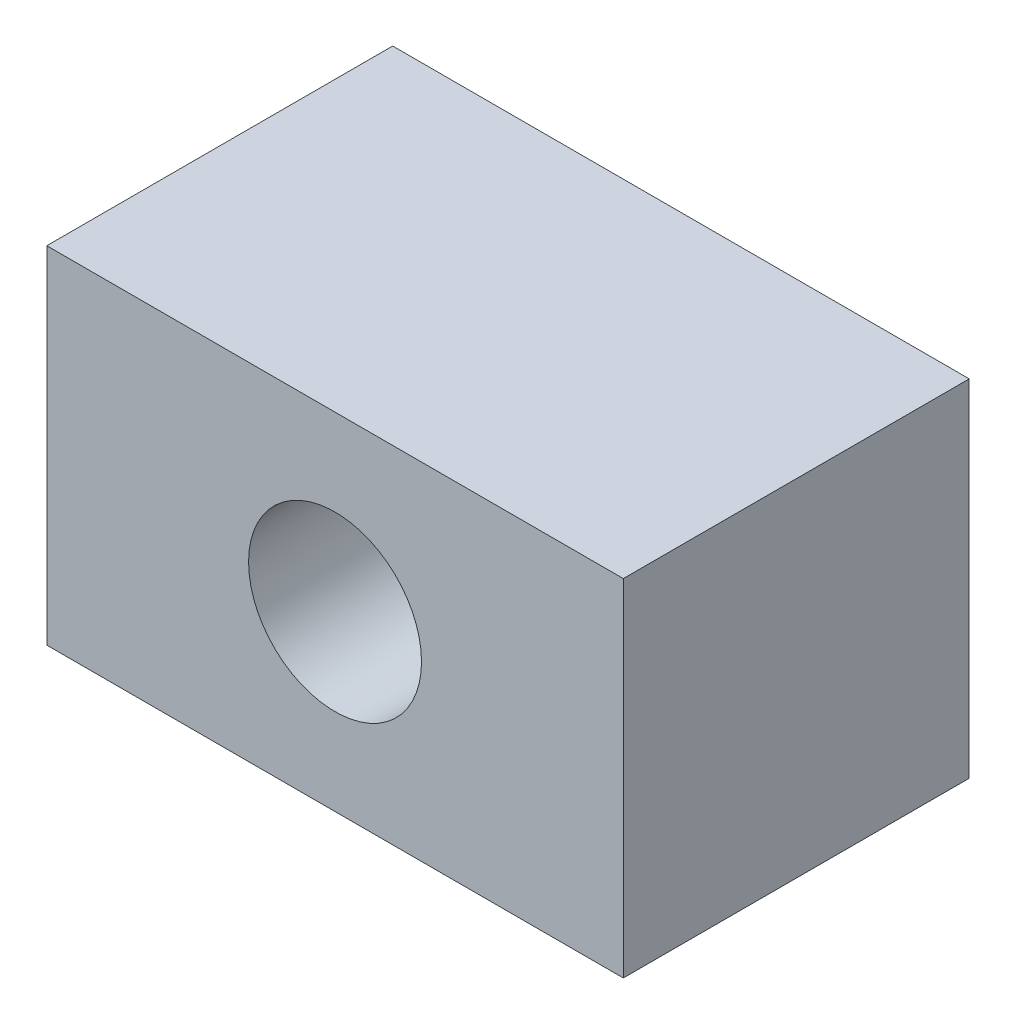
from build123d import *

# Parameters (mm, degrees)
SKETCH1_W           = 30
SKETCH1_H           = 30
BOSS_EXTRUDE1_DEPTH = 50
SKETCH2_R           = 7.5
CUT_EXTRUDE1_DEPTH  = 50


with BuildPart() as part:
    # Sketch1 → Boss-Extrude1 (new body)
    with BuildSketch(Plane(origin=(0, 0, 0), x_dir=(0, 0, -1), z_dir=(1, 0, 0))):
        Rectangle(SKETCH1_W, SKETCH1_H)
    extrude(amount=BOSS_EXTRUDE1_DEPTH)

    # Sketch2 → Cut-Extrude1 (cut)
    with BuildSketch(Plane.XY.offset(15)):
        with Locations((25, 0)):
            Circle(SKETCH2_R)
    extrude(amount=-CUT_EXTRUDE1_DEPTH, mode=Mode.SUBTRACT)


solid = part.part
